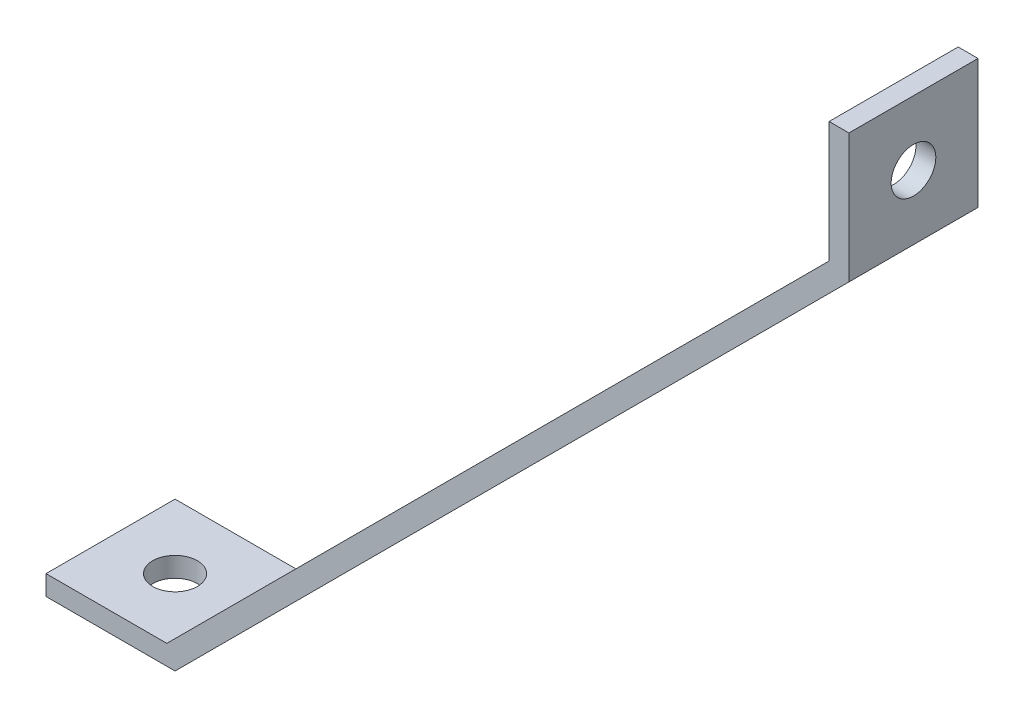
from build123d import *

# Parameters (mm, degrees)
EXTRUDE_THIN1_DEPTH = 20.6375
SKETCH2_R           = 7.14375
CUT_EXTRUDE1_DEPTH  = 293.17123529
SKETCH3_R           = 7.14375
CUT_EXTRUDE2_DEPTH  = 293.17123529


with BuildPart() as part:
    # Sketch1 → Extrude-Thin1 (new, symmetric)
    with BuildSketch(Plane.XY):
        Polygon((-149.038073453, -107.763073453), (-107.763073453, -107.763073453), (107.763073453, 107.763073453), (107.763073453, 149.038073453), (101.413073453, 149.038073453), (101.413073453, 110.393329574), (-110.393329574, -101.413073453), (-149.038073453, -101.413073453), align=None)
    extrude(amount=EXTRUDE_THIN1_DEPTH, both=True)

    # Sketch2 → Cut-Extrude1 (cut, through all)
    with BuildSketch(Plane(origin=(0, -101.413073453, 0), x_dir=(1, 0, 0), z_dir=(0, 1, 0))):
        with Locations(Location((-128.400573453, 0, 0), (0, 0, 270))):
            Circle(SKETCH2_R)
    extrude(amount=-CUT_EXTRUDE1_DEPTH, mode=Mode.SUBTRACT)

    # Sketch3 → Cut-Extrude2 (cut, through all)
    with BuildSketch(Plane.ZY.offset(-101.413073453)):
        with Locations(Location((0, 128.400573453, 0), (0, 0, 270))):
            Circle(SKETCH3_R)
    extrude(amount=-CUT_EXTRUDE2_DEPTH, mode=Mode.SUBTRACT)


solid = part.part
